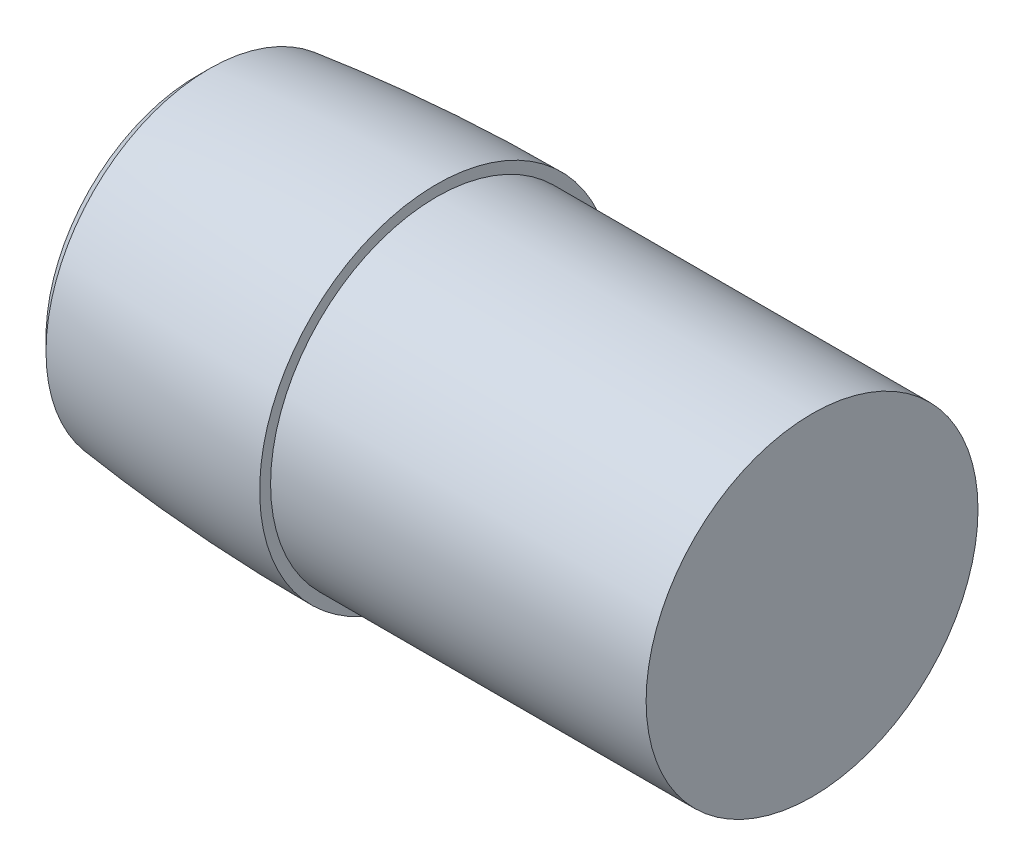
from build123d import *


with BuildPart() as part:
    # Sketch2 → Revolve1 (revolve)
    with BuildSketch(Plane.XY, mode=Mode.PRIVATE) as revolve1_sk:
        with BuildLine():
            Line((-0.061536303, 438.738079124), (-0.061536303, 436.238079124))
            Line((-0.061536303, 436.238079124), (85.938463697, 436.238079124))
            Line((85.938463697, 436.238079124), (85.938463697, 398.238079124))
            Line((85.938463697, 398.238079124), (80.938463697, 398.238079124))
            Line((80.938463697, 398.238079124), (80.938463697, 431.238079124))
            Line((80.938463697, 431.238079124), (-5.061536303, 431.238079124))
            Line((-5.061536303, 431.238079124), (-5.061536303, 436.238079124))
            ThreePointArc((-5.061536303, 436.238079124), (-30.047002163, 435.231499881), (-54.933754935, 432.795059348))
            Line((-54.933754935, 432.795059348), (-52.094482858, 435.634331425))
            ThreePointArc((-52.094482858, 435.634331425), (-26.124143931, 437.959627094), (-0.061536303, 438.738079124))
        make_face()
    revolve(revolve1_sk.sketch.rotate(Axis((-190.061536303, 398.238079124, 0), (-1, 0, 0)), 90), axis=Axis((-190.061536303, 398.238079124, 0), (-1, 0, 0)))


solid = part.part
